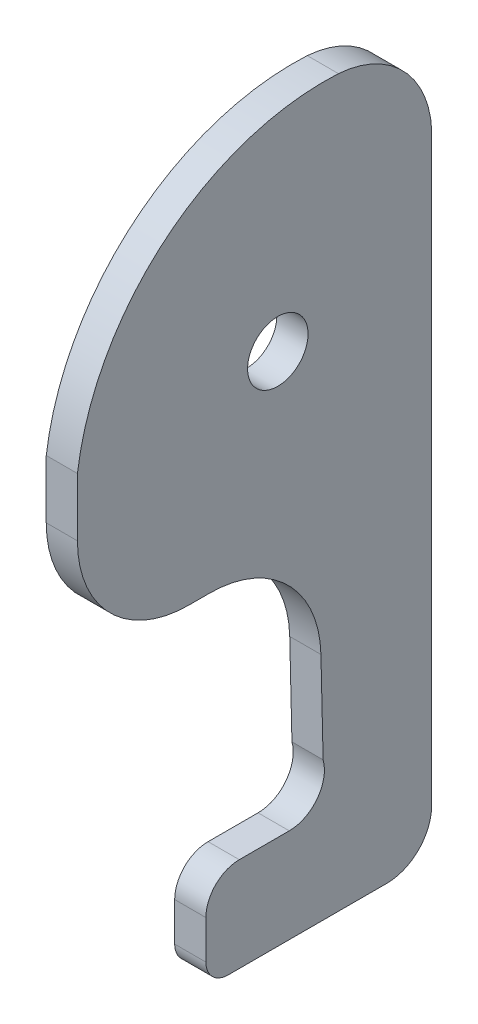
from build123d import *

# Parameters (mm, degrees)
BOSS_EXTRUDE1_DEPTH      = 12
BOSS_EXTRUDE1_DEPTH_BACK = 2
SCALE1_SCALE             = 0.184184676
CUT_EXTRUDE1_REACH       = 177.722
SKETCH4_R                = 2.5


with BuildPart() as part:
    # Sketch3 → Boss-Extrude1 (new, two sides: drawn at the far end of the back side and taken through both)
    with BuildSketch(Plane(origin=(0, 0, 0), x_dir=(0, 0, -1), z_dir=(1, 0, 0)).offset(-BOSS_EXTRUDE1_DEPTH_BACK)):
        with BuildLine():
            Line((0, -60), (0, -86.184781703))
            ThreePointArc((0, -86.184781703), (14.644660941, -121.540120762), (50, -136.184781703))
            Line((50, -136.184781703), (59.297038535, -136.184781703))
            ThreePointArc((59.297038535, -136.184781703), (94.227856727, -150.409958986), (109.282791662, -184.991264087))
            Line((109.282791662, -184.991264087), (110.272400942, -226.437125049))
            ThreePointArc((110.272400942, -226.437125049), (107.627548101, -240.207635718), (95.065077273, -246.437125049))
            Line((95.065077273, -246.437125049), (72.641071037, -246.437125049))
            ThreePointArc((72.641071037, -246.437125049), (62.034469319, -250.830523332), (57.641071037, -261.437125049))
            Line((57.641071037, -261.437125049), (57.641071037, -278.751269833))
            ThreePointArc((57.641071037, -278.751269833), (60.570003225, -285.822337645), (67.641071037, -288.751269833))
            Line((67.641071037, -288.751269833), (116.127942723, -288.751269833))
            Line((116.127942723, -288.751269833), (138.939006392, -288.751269833))
            ThreePointArc((138.939006392, -288.751269833), (153.081142016, -282.893405456), (158.939006392, -268.751269833))
            Line((158.939006392, -268.751269833), (158.939006392, -146.184781703))
            Line((158.939006392, -146.184781703), (158.939006392, -50))
            Line((158.939006392, -50), (158.939006392, -11.480346054))
            ThreePointArc((158.939006392, -11.480346054), (148.053108697, 21.328755123), (117.156078712, 36.830801017))
            ThreePointArc((117.156078712, 36.830801017), (39.60735059, 11.368133348), (0, -60))
        make_face()
    extrude(amount=BOSS_EXTRUDE1_DEPTH + BOSS_EXTRUDE1_DEPTH_BACK)


with BuildPart() as part_1:
    # Scale1: scaled about (5, -104.808897059, -96.321000263)
    add(part.part.scale(SCALE1_SCALE).moved(Location((4.07907662, -85.504704312, -78.580148038))))

    # Sketch4 → Cut-Extrude1 (cut, up to next)
    with BuildSketch(Plane(origin=(6.289292732, 0, 0), x_dir=(0, 0, -1), z_dir=(1, 0, 0)), mode=Mode.PRIVATE) as cut_extrude1_sk1:
        with Locations((95.143312613, -96.09592734)):
            Circle(SKETCH4_R)
    cut_extrude1_tool1 = extrude(cut_extrude1_sk1.sketch, amount=-CUT_EXTRUDE1_REACH, mode=Mode.PRIVATE) & part_1.part
    add(cut_extrude1_tool1.solids().sort_by_distance((6.289293, -96.095927, -95.143313))[0], mode=Mode.SUBTRACT)


solid = part_1.part
